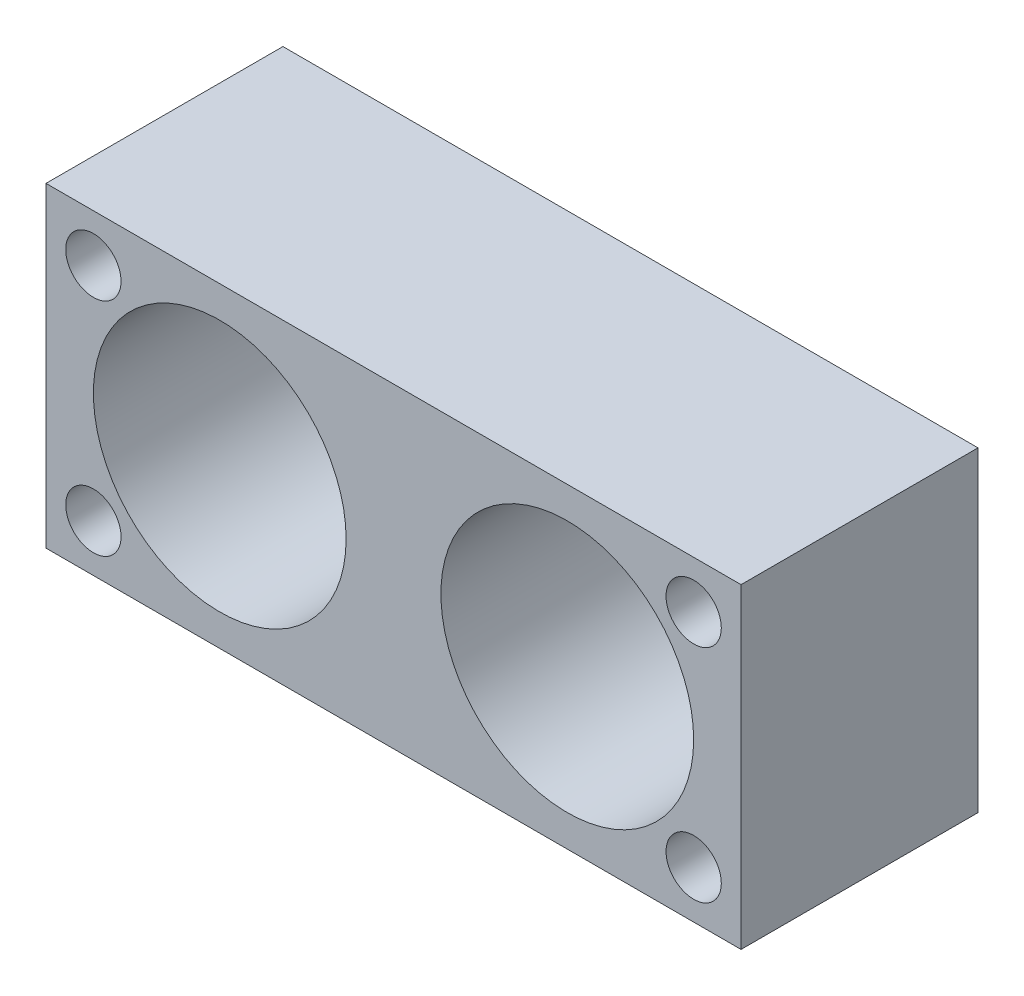
from build123d import *

# Parameters (mm, degrees)
CROQUIS1_W              = 44
CROQUIS1_H              = 20
CROQUIS1_R              = 8
SALIENTE_EXTRUIR1_DEPTH = 15
CROQUIS2_R              = 1.75
CORTAR_EXTRUIR1_DEPTH   = 22


with BuildPart() as part:
    # Croquis1 → Saliente-Extruir1 (new body)
    with BuildSketch(Plane.XY):
        Rectangle(CROQUIS1_W, CROQUIS1_H)
        with Locations((-11, 0)):
            Circle(CROQUIS1_R, mode=Mode.SUBTRACT)
        with Locations((11, 0)):
            Circle(CROQUIS1_R, mode=Mode.SUBTRACT)
    extrude(amount=SALIENTE_EXTRUIR1_DEPTH)

    # Croquis2 → Cortar-Extruir1 (cut)
    with BuildSketch(Plane.XY.offset(15)):
        with Locations((-19, 7)):
            Circle(CROQUIS2_R)
        with Locations((19, -7)):
            Circle(CROQUIS2_R)
        with Locations((19, 7)):
            Circle(CROQUIS2_R)
        with Locations((-19, -7)):
            Circle(CROQUIS2_R)
    extrude(amount=-CORTAR_EXTRUIR1_DEPTH, mode=Mode.SUBTRACT)


solid = part.part
